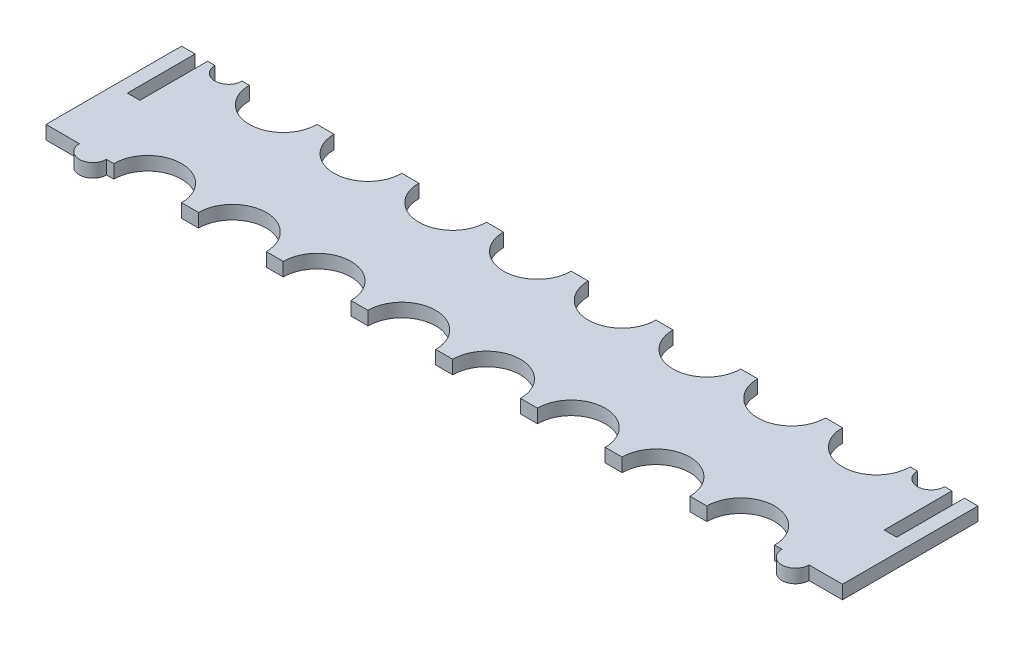
from build123d import *

# Parameters (mm, degrees)
SKETCH1_W               = 235
SKETCH1_H               = 40
BOSS_EXTRUDE1_DEPTH     = 4
SKETCH2_W               = 3.7
SKETCH2_H               = 20
CUT_EXTRUDE1_DEPTH      = 4
SKETCH3_R               = 10
CUT_EXTRUDE2_DEPTH      = 4
LPATTERN1_COUNT         = 8
LPATTERN1_PITCH         = 25
SKETCH4_R               = 4
CUT_EXTRUDE3_DEPTH      = 4
SKETCH5_R               = 4
BOSS_EXTRUDE2_DEPTH     = 4
MIRROR1_COPY_1_SKETCH_R = 10
MIRROR1_COPY_1_DEPTH    = 4
MIRROR1_COPY_2_SKETCH_R = 10
MIRROR1_COPY_2_DEPTH    = 4
MIRROR1_COPY_3_SKETCH_R = 10
MIRROR1_COPY_3_DEPTH    = 4
MIRROR1_COPY_4_SKETCH_R = 10
MIRROR1_COPY_4_DEPTH    = 4
MIRROR1_COPY_5_SKETCH_R = 10
MIRROR1_COPY_5_DEPTH    = 4
MIRROR1_COPY_6_SKETCH_R = 10
MIRROR1_COPY_6_DEPTH    = 4
MIRROR1_COPY_7_SKETCH_R = 10
MIRROR1_COPY_7_DEPTH    = 4


with BuildPart() as part:
    # Sketch1 → Boss-Extrude1 (new body)
    with BuildSketch(Plane(origin=(0, 0, 0), x_dir=(1, 0, 0), z_dir=(0, 1, 0))):
        with Locations((117.5, 20)):
            Rectangle(SKETCH1_W, SKETCH1_H)
    extrude(amount=BOSS_EXTRUDE1_DEPTH)

    # Sketch2 → Cut-Extrude1 (cut)
    with BuildSketch(Plane(origin=(0, 4, 0), x_dir=(1, 0, 0), z_dir=(0, 1, 0))):
        with Locations((5.85, 30)):
            Rectangle(SKETCH2_W, SKETCH2_H)
        with Locations((229.15, 30)):
            Rectangle(SKETCH2_W, SKETCH2_H)
    extrude(amount=-CUT_EXTRUDE1_DEPTH, mode=Mode.SUBTRACT)

    # Sketch3 → Cut-Extrude2 (cut)
    with BuildSketch(Plane(origin=(0, 4, 0), x_dir=(1, 0, 0), z_dir=(0, 1, 0))):
        with Locations((30, 40)):
            Circle(SKETCH3_R)
    cut_extrude2 = extrude(amount=-CUT_EXTRUDE2_DEPTH, mode=Mode.SUBTRACT)

    # LPattern1: Cut-Extrude2 ×8
    with Locations(*[(i * LPATTERN1_PITCH, 0, 0) for i in range(1, LPATTERN1_COUNT)]):
        add(cut_extrude2, mode=Mode.SUBTRACT)

    # Sketch4 → Cut-Extrude3 (cut)
    with BuildSketch(Plane(origin=(0, 4, 0), x_dir=(1, 0, 0), z_dir=(0, 1, 0))):
        with Locations((221.15, 40)):
            Circle(SKETCH4_R)
        with Locations((13.85, 40)):
            Circle(SKETCH4_R)
    extrude(amount=-CUT_EXTRUDE3_DEPTH, mode=Mode.SUBTRACT)

    # Sketch5 → Boss-Extrude2 (add)
    with BuildSketch(Plane(origin=(0, 4, 0), x_dir=(1, 0, 0), z_dir=(0, 1, 0))):
        with Locations((221.15, 0)):
            Circle(SKETCH5_R)
        with Locations((13.85, 0)):
            Circle(SKETCH5_R)
    extrude(amount=-BOSS_EXTRUDE2_DEPTH)

    # Mirror1: Cut-Extrude2 across plane
    add(cut_extrude2.mirror(Plane(origin=(0, 0, -20), x_dir=(1, 0, 0), z_dir=(0, 0, -1))), mode=Mode.SUBTRACT)

    # Mirror1 copy 1 sketch → Mirror1 copy 1 (cut)
    with BuildSketch(Plane(origin=(25, 4, -40), x_dir=(1, 0, 0), z_dir=(0, 1, 0))):
        with Locations((30, -40)):
            Circle(MIRROR1_COPY_1_SKETCH_R)
    extrude(amount=-MIRROR1_COPY_1_DEPTH, mode=Mode.SUBTRACT)

    # Mirror1 copy 2 sketch → Mirror1 copy 2 (cut)
    with BuildSketch(Plane(origin=(50, 4, -40), x_dir=(1, 0, 0), z_dir=(0, 1, 0))):
        with Locations((30, -40)):
            Circle(MIRROR1_COPY_2_SKETCH_R)
    extrude(amount=-MIRROR1_COPY_2_DEPTH, mode=Mode.SUBTRACT)

    # Mirror1 copy 3 sketch → Mirror1 copy 3 (cut)
    with BuildSketch(Plane(origin=(75, 4, -40), x_dir=(1, 0, 0), z_dir=(0, 1, 0))):
        with Locations((30, -40)):
            Circle(MIRROR1_COPY_3_SKETCH_R)
    extrude(amount=-MIRROR1_COPY_3_DEPTH, mode=Mode.SUBTRACT)

    # Mirror1 copy 4 sketch → Mirror1 copy 4 (cut)
    with BuildSketch(Plane(origin=(100, 4, -40), x_dir=(1, 0, 0), z_dir=(0, 1, 0))):
        with Locations((30, -40)):
            Circle(MIRROR1_COPY_4_SKETCH_R)
    extrude(amount=-MIRROR1_COPY_4_DEPTH, mode=Mode.SUBTRACT)

    # Mirror1 copy 5 sketch → Mirror1 copy 5 (cut)
    with BuildSketch(Plane(origin=(125, 4, -40), x_dir=(1, 0, 0), z_dir=(0, 1, 0))):
        with Locations((30, -40)):
            Circle(MIRROR1_COPY_5_SKETCH_R)
    extrude(amount=-MIRROR1_COPY_5_DEPTH, mode=Mode.SUBTRACT)

    # Mirror1 copy 6 sketch → Mirror1 copy 6 (cut)
    with BuildSketch(Plane(origin=(150, 4, -40), x_dir=(1, 0, 0), z_dir=(0, 1, 0))):
        with Locations((30, -40)):
            Circle(MIRROR1_COPY_6_SKETCH_R)
    extrude(amount=-MIRROR1_COPY_6_DEPTH, mode=Mode.SUBTRACT)

    # Mirror1 copy 7 sketch → Mirror1 copy 7 (cut)
    with BuildSketch(Plane(origin=(175, 4, -40), x_dir=(1, 0, 0), z_dir=(0, 1, 0))):
        with Locations((30, -40)):
            Circle(MIRROR1_COPY_7_SKETCH_R)
    extrude(amount=-MIRROR1_COPY_7_DEPTH, mode=Mode.SUBTRACT)


solid = part.part
